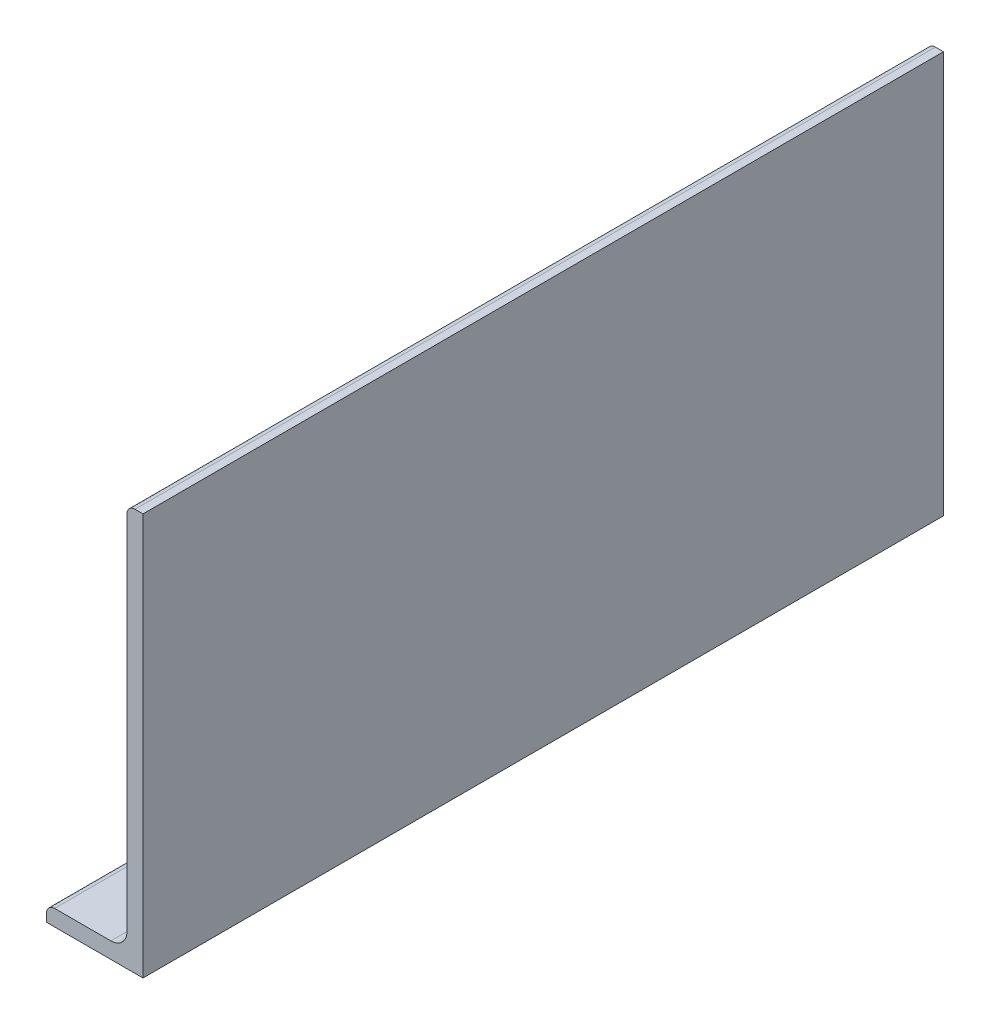
from build123d import *

# Parameters (mm, degrees)
BOSS_EXTRUDE1_DEPTH = 99.58
FILLET1_R           = 1
FILLET2_R           = 2
SKETCH2_R           = 1.6
CUT_EXTRUDE1_DEPTH  = 297.13597768


with BuildPart() as part:
    # Sketch1 → Boss-Extrude1 (new body)
    with BuildSketch(Plane.XY):
        Polygon((274.729577724, -5.490034005), (274.729577724, -55.490034005), (262.729577724, -55.490034005), (262.729577724, -53.490034005), (272.729577724, -53.490034005), (272.729577724, -5.490034005), align=None)
    extrude(amount=BOSS_EXTRUDE1_DEPTH)

    # Fillet1
    fillet1_edges = [part.edges().sort_by_distance(p)[0] for p in [
        (262.729577724, -53.490034005, 49.79),
        (272.729577724, -5.490034005, 49.79),
    ]]
    fillet(fillet1_edges, radius=FILLET1_R)

    # Fillet2
    fillet2_edges = [part.edges().sort_by_distance(p)[0] for p in [
        (272.729577724, -53.490034005, 49.79),
    ]]
    fillet(fillet2_edges, radius=FILLET2_R)

    # Sketch2 → Cut-Extrude1 (cut, through all)
    with BuildSketch(Plane(origin=(0, -53.490034005, 0), x_dir=(1, 0, 0), z_dir=(0, 1, 0))):
        with Locations(Location((267.229577724, -20, 0), (0, 0, 180))):
            Circle(SKETCH2_R)
        with Locations(Location((267.229577724, -79.58, 0), (0, 0, 180))):
            Circle(SKETCH2_R)
    extrude(amount=-CUT_EXTRUDE1_DEPTH, mode=Mode.SUBTRACT)


solid = part.part
